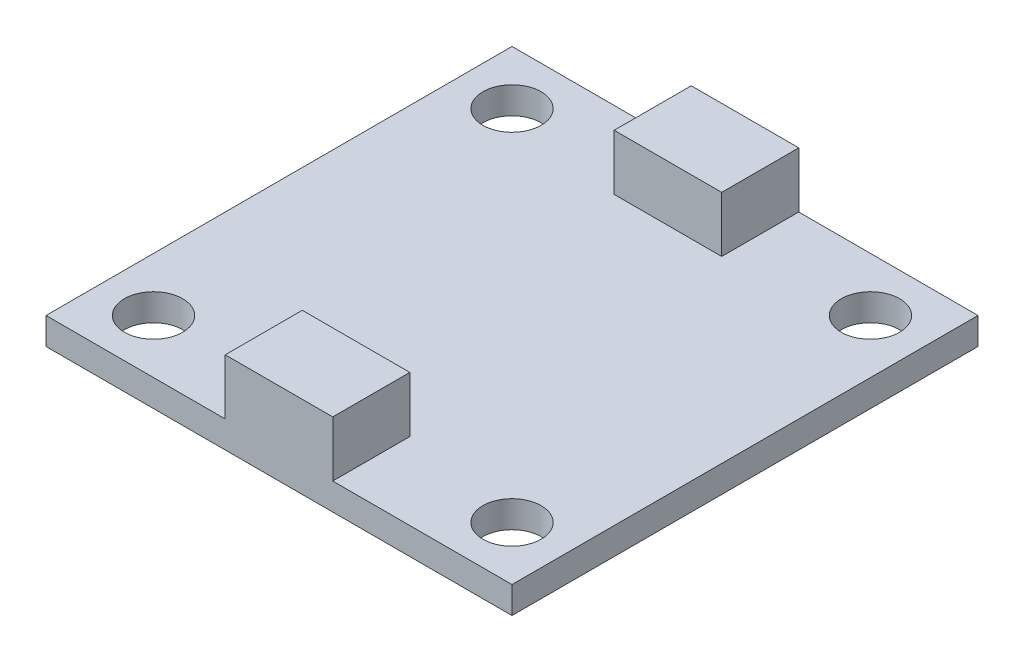
from build123d import *

# Parameters (mm, degrees)
SKETCH1_W           = 26
SKETCH1_H           = 26
BOSS_EXTRUDE1_DEPTH = 1.5
SKETCH2_R           = 1.625
CUT_EXTRUDE1_DEPTH  = 19.445866746
SKETCH3_W           = 6
SKETCH3_H           = 4.3
BOSS_EXTRUDE2_DEPTH = 3.1


with BuildPart() as part:
    # Sketch1 → Boss-Extrude1 (new body)
    with BuildSketch(Plane(origin=(0, 0, 0), x_dir=(1, 0, 0), z_dir=(0, 1, 0))):
        Rectangle(SKETCH1_W, SKETCH1_H)
    extrude(amount=BOSS_EXTRUDE1_DEPTH)

    # Sketch2 → Cut-Extrude1 (cut, through all)
    with BuildSketch(Plane(origin=(0, 1.5, 0), x_dir=(1, 0, 0), z_dir=(0, 1, 0))):
        with Locations(Location((-10, 10, 0), (0, 0, 270))):
            Circle(SKETCH2_R)
        with Locations(Location((10, 10, 0), (0, 0, 270))):
            Circle(SKETCH2_R)
        with Locations(Location((10, -10, 0), (0, 0, 270))):
            Circle(SKETCH2_R)
        with Locations(Location((-10, -10, 0), (0, 0, 270))):
            Circle(SKETCH2_R)
    extrude(amount=-CUT_EXTRUDE1_DEPTH, mode=Mode.SUBTRACT)

    # Sketch3 → Boss-Extrude2 (add)
    with BuildSketch(Plane(origin=(0, 1.5, 0), x_dir=(1, 0, 0), z_dir=(0, 1, 0))):
        with Locations((0, 10.85)):
            Rectangle(SKETCH3_W, SKETCH3_H)
        with Locations((0, -10.85)):
            Rectangle(SKETCH3_W, SKETCH3_H)
    extrude(amount=BOSS_EXTRUDE2_DEPTH)


solid = part.part
